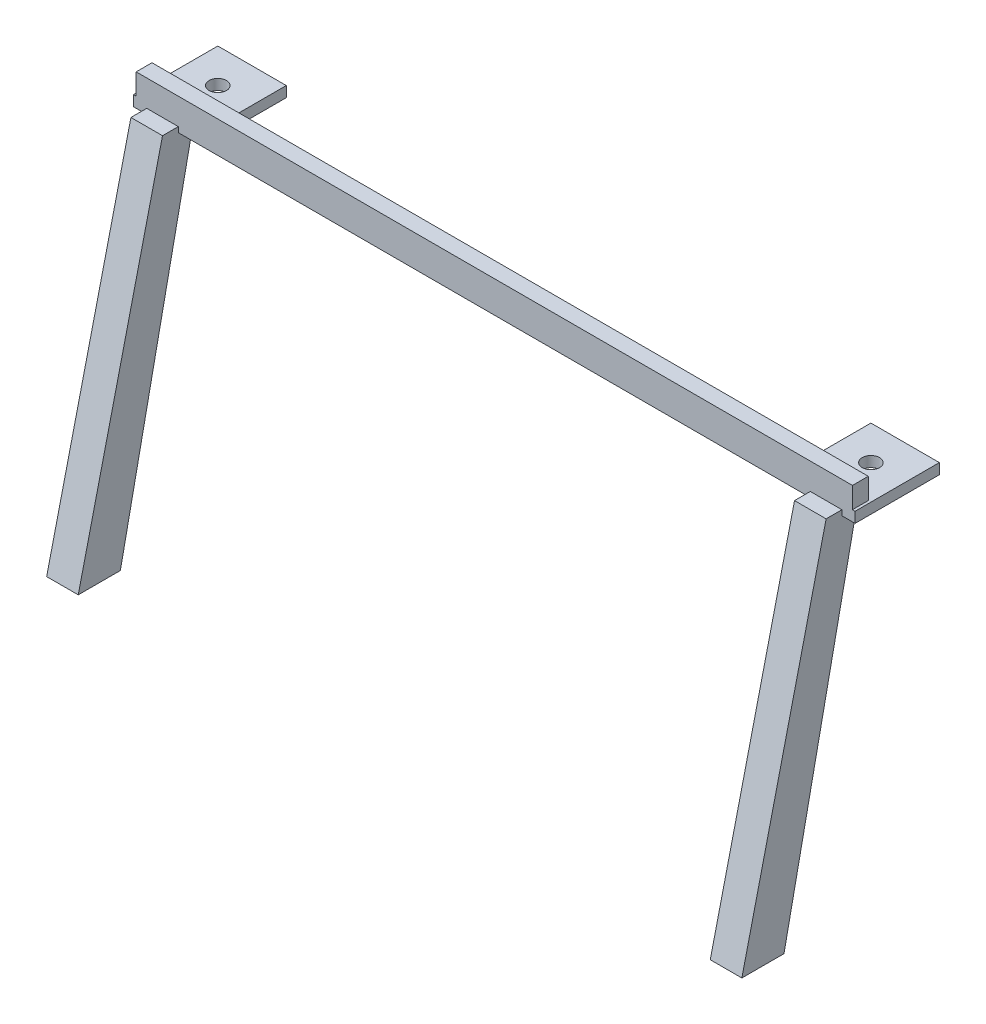
from build123d import *

# Parameters (mm, degrees)
SKETCH_1_W                    = 136
SKETCH_1_H                    = 6
F_3MM_DEPTH                   = 3
EXTRUDE_START                 = -13
SKETCH_2_W                    = 13
SKETCH_2_H                    = 2
EXTRUDE_1_DEPTH               = 16
CUT_EXTRUDE_M3_1_DEPTH        = 100
CUT_EXTRUDE_M3_1_DEPTH_BACK   = 100
SKETCH_3_R                    = 1.65
SKETCH_4_W                    = 13
SKETCH_4_H                    = 2
EXTRUDE_1_2_DEPTH             = 16
CUT_EXTRUDE_M3_1_2_DEPTH      = 100
CUT_EXTRUDE_M3_1_2_DEPTH_BACK = 100
SKETCH_5_R                    = 1.65
F_6MM_1_START                 = -66
F_6MM_1_DEPTH                 = 6
F_6MM_1_START_2               = 60
F_6MM_1_2_DEPTH               = 6


with BuildPart() as part:
    # 草图1 → 全开放接口区侧翼_3mm (new body)
    with BuildSketch(Plane.XY):
        with Locations((0, 81.5)):
            Rectangle(SKETCH_1_W, SKETCH_1_H)
    extrude(amount=F_3MM_DEPTH)

    # 草图2 → Extrude 1 (add)
    with BuildSketch(Plane.XY.offset(EXTRUDE_START)):
        with Locations((-62, 79.5)):
            Rectangle(SKETCH_2_W, SKETCH_2_H)
    extrude(amount=EXTRUDE_1_DEPTH)

    # 草图3 → Cut-Extrude M3_-1 (cut, two sides: drawn at the far end of the back side and taken through both)
    with BuildSketch(Plane(origin=(0, 0, 0), x_dir=(1, 0, 0), z_dir=(0, 1, 0)).offset(-CUT_EXTRUDE_M3_1_DEPTH_BACK)):
        with Locations(Location((-62, 6.5, 0), (0, 0, 270))):
            Circle(SKETCH_3_R)
    extrude(amount=CUT_EXTRUDE_M3_1_DEPTH + CUT_EXTRUDE_M3_1_DEPTH_BACK, mode=Mode.SUBTRACT)

    # 草图4 → Extrude 1 2 (add)
    with BuildSketch(Plane.XY.offset(EXTRUDE_START)):
        with Locations((62, 79.5)):
            Rectangle(SKETCH_4_W, SKETCH_4_H)
    extrude(amount=EXTRUDE_1_2_DEPTH)

    # 草图5 → Cut-Extrude M3_1 2 (cut, two sides: drawn at the far end of the back side and taken through both)
    with BuildSketch(Plane(origin=(0, 0, 0), x_dir=(1, 0, 0), z_dir=(0, 1, 0)).offset(-CUT_EXTRUDE_M3_1_2_DEPTH_BACK)):
        with Locations(Location((62, 6.5, 0), (0, 0, 270))):
            Circle(SKETCH_5_R)
    extrude(amount=CUT_EXTRUDE_M3_1_2_DEPTH + CUT_EXTRUDE_M3_1_2_DEPTH_BACK, mode=Mode.SUBTRACT)

    # 草图6 → 6mm_-1 (add)
    with BuildSketch(Plane(origin=(0, 0, 0), x_dir=(0, 0, -1), z_dir=(1, 0, 0)).offset(F_6MM_1_START)):
        Polygon((0, 79.5), (-6, 79.5), (-22, 12), (-14, 12), align=None)
    extrude(amount=F_6MM_1_DEPTH)

    # 草图7 → 6mm_1 2 (add)
    with BuildSketch(Plane(origin=(0, 0, 0), x_dir=(0, 0, -1), z_dir=(1, 0, 0)).offset(F_6MM_1_START_2)):
        Polygon((0, 79.5), (-6, 79.5), (-22, 12), (-14, 12), align=None)
    extrude(amount=F_6MM_1_2_DEPTH)


solid = part.part
